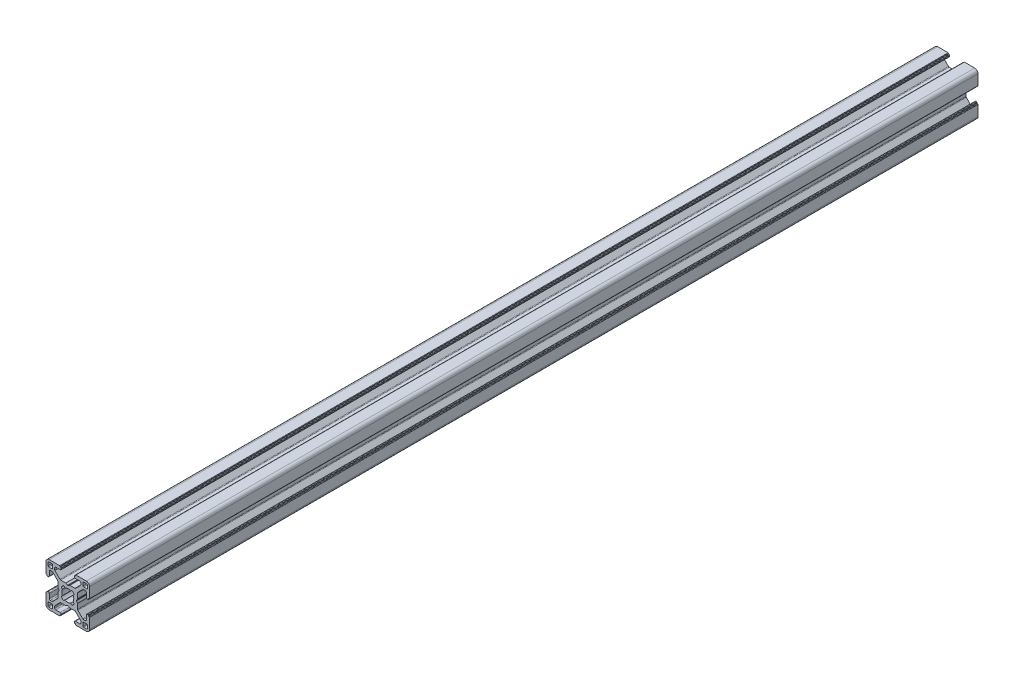
from build123d import *

# Parameters (mm, degrees)
ESTRUSIONE_ESTRUSIONE1_DEPTH = 408


with BuildPart() as part:
    # Schizzo1 → Estrusione-Estrusione1 (new body)
    with BuildSketch(Plane.XY.offset(100)):
        with BuildLine():
            Line((-9.299999732, 3), (-8.999999732, 3))
            ThreePointArc((-8.999999732, 3), (-8.646446341, 3.146446609), (-8.499999732, 3.5))
            Line((-8.499999732, 3.5), (-8.499999732, 5.499999605))
            ThreePointArc((-8.499999732, 5.499999605), (-8.353553123, 5.853552995), (-7.999999732, 5.999999605))
            Line((-7.999999732, 5.999999605), (-7.267766685, 5.999999605))
            ThreePointArc((-7.267766685, 5.999999605), (-7.076424969, 5.961939371), (-6.914213294, 5.853552995))
            Line((-6.914213294, 5.853552995), (-4.646446398, 3.585786099))
            ThreePointArc((-4.646446398, 3.585786099), (-4.538060023, 3.423574425), (-4.499999789, 3.232232708))
            Line((-4.499999789, 3.232232708), (-4.499999789, 0.953589302))
            ThreePointArc((-4.499999789, 0.953589302), (-4.493184953, 0.90182549), (-4.473204867, 0.853589297))
            Line((-4.473204867, 0.853589297), (-4.038119841, 0.099999969))
            ThreePointArc((-4.038119841, 0.099999969), (-4.011324929, 0), (-4.038119841, -0.099999969))
            Line((-4.038119841, -0.099999969), (-4.473204867, -0.853589297))
            ThreePointArc((-4.473204867, -0.853589297), (-4.493184953, -0.90182549), (-4.499999789, -0.953589302))
            Line((-4.499999789, -0.953589302), (-4.499999789, -3.232232708))
            ThreePointArc((-4.499999789, -3.232232708), (-4.538060023, -3.423574425), (-4.646446398, -3.585786099))
            Line((-4.646446398, -3.585786099), (-6.914213294, -5.853552995))
            ThreePointArc((-6.914213294, -5.853552995), (-7.076424969, -5.961939371), (-7.267766685, -5.999999605))
            Line((-7.267766685, -5.999999605), (-7.999999732, -5.999999605))
            ThreePointArc((-7.999999732, -5.999999605), (-8.353553123, -5.853552995), (-8.499999732, -5.499999605))
            Line((-8.499999732, -5.499999605), (-8.499999732, -3.5))
            ThreePointArc((-8.499999732, -3.5), (-8.646446341, -3.146446609), (-8.999999732, -3))
            Line((-8.999999732, -3), (-9.299999732, -3))
            ThreePointArc((-9.299999732, -3), (-9.441421088, -3.058578644), (-9.499999732, -3.2))
            Line((-9.499999732, -3.2), (-9.499999732, -3.349999605))
            ThreePointArc((-9.499999732, -3.349999605), (-9.558578376, -3.491420961), (-9.699999732, -3.549999605))
            Line((-9.699999732, -3.549999605), (-9.8, -3.549999605))
            ThreePointArc((-9.8, -3.549999605), (-9.941421356, -3.608578248), (-10, -3.749999605))
            Line((-10, -3.749999605), (-10, -8.5))
            ThreePointArc((-10, -8.5), (-9.560660172, -9.560660172), (-8.5, -10))
            Line((-8.5, -10), (-3.750000228, -10))
            ThreePointArc((-3.750000228, -10), (-3.608578871, -9.941421356), (-3.550000228, -9.8))
            Line((-3.550000228, -9.8), (-3.550000228, -9.7))
            ThreePointArc((-3.550000228, -9.7), (-3.491421584, -9.558578644), (-3.350000228, -9.5))
            Line((-3.350000228, -9.5), (-3.2, -9.5))
            ThreePointArc((-3.2, -9.5), (-3.058578644, -9.441421356), (-3, -9.3))
            Line((-3, -9.3), (-3, -8.999999673))
            ThreePointArc((-3, -8.999999673), (-3.146446609, -8.646446283), (-3.5, -8.499999673))
            Line((-3.5, -8.499999673), (-5.500000686, -8.499999673))
            ThreePointArc((-5.500000686, -8.499999673), (-5.853554077, -8.353553064), (-6.000000686, -7.999999673))
            Line((-6.000000686, -7.999999673), (-6.000000686, -7.267766626))
            ThreePointArc((-6.000000686, -7.267766626), (-5.961940448, -7.076424899), (-5.853554059, -6.914213219))
            Line((-5.853554059, -6.914213219), (-3.585787212, -4.646446592))
            ThreePointArc((-3.585787212, -4.646446592), (-3.423575544, -4.538060229), (-3.232233839, -4.5))
            Line((-3.232233839, -4.5), (-0.953590312, -4.5))
            ThreePointArc((-0.953590312, -4.5), (-0.901826505, -4.493185166), (-0.853590316, -4.473205083))
            Line((-0.853590316, -4.473205083), (-0.100000045, -4.038119562))
            ThreePointArc((-0.100000045, -4.038119562), (0, -4.011324632), (0.100000045, -4.038119562))
            Line((0.100000045, -4.038119562), (0.853590316, -4.473205083))
            ThreePointArc((0.853590316, -4.473205083), (0.901826505, -4.493185166), (0.953590312, -4.5))
            Line((0.953590312, -4.5), (3.23223292, -4.5))
            ThreePointArc((3.23223292, -4.5), (3.423574636, -4.538060234), (3.58578631, -4.646446609))
            Line((3.58578631, -4.646446609), (5.853554077, -6.914214376))
            ThreePointArc((5.853554077, -6.914214376), (5.961940452, -7.07642605), (6.000000686, -7.267767766))
            Line((6.000000686, -7.267767766), (6.000000686, -7.999999673))
            ThreePointArc((6.000000686, -7.999999673), (5.853554077, -8.353553064), (5.500000686, -8.499999673))
            Line((5.500000686, -8.499999673), (3.5, -8.499999673))
            ThreePointArc((3.5, -8.499999673), (3.146446609, -8.646446283), (3, -8.999999673))
            Line((3, -8.999999673), (3, -9.3))
            ThreePointArc((3, -9.3), (3.058578644, -9.441421356), (3.2, -9.5))
            Line((3.2, -9.5), (3.350000228, -9.5))
            ThreePointArc((3.350000228, -9.5), (3.491421584, -9.558578644), (3.550000228, -9.7))
            Line((3.550000228, -9.7), (3.550000228, -9.8))
            ThreePointArc((3.550000228, -9.8), (3.608578871, -9.941421356), (3.750000228, -10))
            Line((3.750000228, -10), (8.5, -10))
            ThreePointArc((8.5, -10), (9.560660172, -9.560660172), (10, -8.5))
            Line((10, -8.5), (10, -3.749999605))
            ThreePointArc((10, -3.749999605), (9.941421356, -3.608578248), (9.8, -3.549999605))
            Line((9.8, -3.549999605), (9.699999732, -3.549999605))
            ThreePointArc((9.699999732, -3.549999605), (9.558578376, -3.491420961), (9.499999732, -3.349999605))
            Line((9.499999732, -3.349999605), (9.499999732, -3.2))
            ThreePointArc((9.499999732, -3.2), (9.441421088, -3.058578644), (9.299999732, -3))
            Line((9.299999732, -3), (8.999999732, -3))
            ThreePointArc((8.999999732, -3), (8.646446341, -3.146446609), (8.499999732, -3.5))
            Line((8.499999732, -3.5), (8.499999732, -5.499999605))
            ThreePointArc((8.499999732, -5.499999605), (8.353553123, -5.853552995), (7.999999732, -5.999999605))
            Line((7.999999732, -5.999999605), (7.267766789, -5.999999605))
            ThreePointArc((7.267766789, -5.999999605), (7.076425084, -5.961939376), (6.914213416, -5.853553012))
            Line((6.914213416, -5.853553012), (4.646446415, -3.585786233))
            ThreePointArc((4.646446415, -3.585786233), (4.538060027, -3.423574553), (4.499999789, -3.232232825))
            Line((4.499999789, -3.232232825), (4.499999789, -0.953589302))
            ThreePointArc((4.499999789, -0.953589302), (4.493184953, -0.90182549), (4.473204867, -0.853589297))
            Line((4.473204867, -0.853589297), (4.038119841, -0.099999969))
            ThreePointArc((4.038119841, -0.099999969), (4.011324929, 0), (4.038119841, 0.099999969))
            Line((4.038119841, 0.099999969), (4.473204867, 0.853589297))
            ThreePointArc((4.473204867, 0.853589297), (4.493184953, 0.90182549), (4.499999789, 0.953589302))
            Line((4.499999789, 0.953589302), (4.499999789, 3.232232825))
            ThreePointArc((4.499999789, 3.232232825), (4.538060027, 3.423574553), (4.646446415, 3.585786233))
            Line((4.646446415, 3.585786233), (6.914213416, 5.853553012))
            ThreePointArc((6.914213416, 5.853553012), (7.076425084, 5.961939376), (7.267766789, 5.999999605))
            Line((7.267766789, 5.999999605), (7.999999732, 5.999999605))
            ThreePointArc((7.999999732, 5.999999605), (8.353553123, 5.853552995), (8.499999732, 5.499999605))
            Line((8.499999732, 5.499999605), (8.499999732, 3.5))
            ThreePointArc((8.499999732, 3.5), (8.646446341, 3.146446609), (8.999999732, 3))
            Line((8.999999732, 3), (9.299999732, 3))
            ThreePointArc((9.299999732, 3), (9.441421088, 3.058578644), (9.499999732, 3.2))
            Line((9.499999732, 3.2), (9.499999732, 3.349999605))
            ThreePointArc((9.499999732, 3.349999605), (9.558578376, 3.491420961), (9.699999732, 3.549999605))
            Line((9.699999732, 3.549999605), (9.8, 3.549999605))
            ThreePointArc((9.8, 3.549999605), (9.941421356, 3.608578248), (10, 3.749999605))
            Line((10, 3.749999605), (10, 8.5))
            ThreePointArc((10, 8.5), (9.560660172, 9.560660172), (8.5, 10))
            Line((8.5, 10), (3.750000228, 10))
            ThreePointArc((3.750000228, 10), (3.608578871, 9.941421356), (3.550000228, 9.8))
            Line((3.550000228, 9.8), (3.550000228, 9.7))
            ThreePointArc((3.550000228, 9.7), (3.491421584, 9.558578644), (3.350000228, 9.5))
            Line((3.350000228, 9.5), (3.2, 9.5))
            ThreePointArc((3.2, 9.5), (3.058578644, 9.441421356), (3, 9.3))
            Line((3, 9.3), (3, 8.999999673))
            ThreePointArc((3, 8.999999673), (3.146446609, 8.646446283), (3.5, 8.499999673))
            Line((3.5, 8.499999673), (5.500000686, 8.499999673))
            ThreePointArc((5.500000686, 8.499999673), (5.853554077, 8.353553064), (6.000000686, 7.999999673))
            Line((6.000000686, 7.999999673), (6.000000686, 7.267767766))
            ThreePointArc((6.000000686, 7.267767766), (5.961940452, 7.07642605), (5.853554077, 6.914214376))
            Line((5.853554077, 6.914214376), (3.58578631, 4.646446609))
            ThreePointArc((3.58578631, 4.646446609), (3.423574636, 4.538060234), (3.23223292, 4.5))
            Line((3.23223292, 4.5), (0.953590312, 4.5))
            ThreePointArc((0.953590312, 4.5), (0.901826505, 4.493185166), (0.853590316, 4.473205083))
            Line((0.853590316, 4.473205083), (0.100000045, 4.038119562))
            ThreePointArc((0.100000045, 4.038119562), (0, 4.011324632), (-0.100000045, 4.038119562))
            Line((-0.100000045, 4.038119562), (-0.853590316, 4.473205083))
            ThreePointArc((-0.853590316, 4.473205083), (-0.901826505, 4.493185166), (-0.953590312, 4.5))
            Line((-0.953590312, 4.5), (-3.232233839, 4.5))
            ThreePointArc((-3.232233839, 4.5), (-3.423575544, 4.538060229), (-3.585787212, 4.646446592))
            Line((-3.585787212, 4.646446592), (-5.853554059, 6.914213219))
            ThreePointArc((-5.853554059, 6.914213219), (-5.961940448, 7.076424899), (-6.000000686, 7.267766626))
            Line((-6.000000686, 7.267766626), (-6.000000686, 7.999999673))
            ThreePointArc((-6.000000686, 7.999999673), (-5.853554077, 8.353553064), (-5.500000686, 8.499999673))
            Line((-5.500000686, 8.499999673), (-3.5, 8.499999673))
            ThreePointArc((-3.5, 8.499999673), (-3.146446609, 8.646446283), (-3, 8.999999673))
            Line((-3, 8.999999673), (-3, 9.3))
            ThreePointArc((-3, 9.3), (-3.058578644, 9.441421356), (-3.2, 9.5))
            Line((-3.2, 9.5), (-3.350000228, 9.5))
            ThreePointArc((-3.350000228, 9.5), (-3.491421584, 9.558578644), (-3.550000228, 9.7))
            Line((-3.550000228, 9.7), (-3.550000228, 9.8))
            ThreePointArc((-3.550000228, 9.8), (-3.608578871, 9.941421356), (-3.750000228, 10))
            Line((-3.750000228, 10), (-8.5, 10))
            ThreePointArc((-8.5, 10), (-9.560660172, 9.560660172), (-10, 8.5))
            Line((-10, 8.5), (-10, 3.749999605))
            ThreePointArc((-10, 3.749999605), (-9.941421356, 3.608578248), (-9.8, 3.549999605))
            Line((-9.8, 3.549999605), (-9.699999732, 3.549999605))
            ThreePointArc((-9.699999732, 3.549999605), (-9.558578376, 3.491420961), (-9.499999732, 3.349999605))
            Line((-9.499999732, 3.349999605), (-9.499999732, 3.2))
            ThreePointArc((-9.499999732, 3.2), (-9.441421088, 3.058578644), (-9.299999732, 3))
        make_face()
        with BuildLine():
            Line((-1.91389502, 2.989640962), (-1.258185436, 2.445295362))
            ThreePointArc((-1.258185436, 2.445295362), (0, 2.75), (1.258185436, 2.445295362))
            Line((1.258185436, 2.445295362), (1.91389502, 2.989640962))
            ThreePointArc((1.91389502, 2.989640962), (2.511737261, 2.508410485), (2.992174953, 1.909930962))
            Line((2.992174953, 1.909930962), (2.445295423, 1.258185317))
            ThreePointArc((2.445295423, 1.258185317), (2.75, 0), (2.445295423, -1.258185317))
            Line((2.445295423, -1.258185317), (2.992174953, -1.909930962))
            ThreePointArc((2.992174953, -1.909930962), (2.511737261, -2.508410485), (1.91389502, -2.989640962))
            Line((1.91389502, -2.989640962), (1.258185436, -2.445295362))
            ThreePointArc((1.258185436, -2.445295362), (0, -2.75), (-1.258185436, -2.445295362))
            Line((-1.258185436, -2.445295362), (-1.91389502, -2.989640962))
            ThreePointArc((-1.91389502, -2.989640962), (-2.511737261, -2.508410485), (-2.992174953, -1.909930962))
            Line((-2.992174953, -1.909930962), (-2.445295423, -1.258185317))
            ThreePointArc((-2.445295423, -1.258185317), (-2.75, 0), (-2.445295423, 1.258185317))
            Line((-2.445295423, 1.258185317), (-2.992174953, 1.909930962))
            ThreePointArc((-2.992174953, 1.909930962), (-2.511737261, 2.508410485), (-1.91389502, 2.989640962))
        make_face(mode=Mode.SUBTRACT)
        with BuildLine():
            Line((8.699999314, 7.000000686), (7.3, 7.000000686))
            ThreePointArc((7.3, 7.000000686), (7.087867966, 7.087868652), (7, 7.300000686))
            Line((7, 7.300000686), (7, 8.7))
            ThreePointArc((7, 8.7), (7.087867966, 8.912132034), (7.3, 9))
            Line((7.3, 9), (8.699999314, 9))
            ThreePointArc((8.699999314, 9), (8.912131348, 8.912132034), (8.999999314, 8.7))
            Line((8.999999314, 8.7), (8.999999314, 7.300000686))
            ThreePointArc((8.999999314, 7.300000686), (8.912131348, 7.087868652), (8.699999314, 7.000000686))
        make_face(mode=Mode.SUBTRACT)
        with BuildLine():
            Line((-7.300000686, 7.000000686), (-8.7, 7.000000686))
            ThreePointArc((-8.7, 7.000000686), (-8.912132034, 7.087868652), (-9, 7.300000686))
            Line((-9, 7.300000686), (-9, 8.7))
            ThreePointArc((-9, 8.7), (-8.912132034, 8.912132034), (-8.7, 9))
            Line((-8.7, 9), (-7.300000686, 9))
            ThreePointArc((-7.300000686, 9), (-7.087868652, 8.912132034), (-7.000000686, 8.7))
            Line((-7.000000686, 8.7), (-7.000000686, 7.300000686))
            ThreePointArc((-7.000000686, 7.300000686), (-7.087868652, 7.087868652), (-7.300000686, 7.000000686))
        make_face(mode=Mode.SUBTRACT)
        with BuildLine():
            Line((8.699999314, -8.999999314), (7.3, -8.999999314))
            ThreePointArc((7.3, -8.999999314), (7.087867966, -8.912131348), (7, -8.699999314))
            Line((7, -8.699999314), (7, -7.3))
            ThreePointArc((7, -7.3), (7.087867966, -7.087867966), (7.3, -7))
            Line((7.3, -7), (8.699999314, -7))
            ThreePointArc((8.699999314, -7), (8.912131348, -7.087867966), (8.999999314, -7.3))
            Line((8.999999314, -7.3), (8.999999314, -8.699999314))
            ThreePointArc((8.999999314, -8.699999314), (8.912131348, -8.912131348), (8.699999314, -8.999999314))
        make_face(mode=Mode.SUBTRACT)
        with BuildLine():
            Line((-7.300000686, -8.999999314), (-8.7, -8.999999314))
            ThreePointArc((-8.7, -8.999999314), (-8.912132034, -8.912131348), (-9, -8.699999314))
            Line((-9, -8.699999314), (-9, -7.3))
            ThreePointArc((-9, -7.3), (-8.912132034, -7.087867966), (-8.7, -7))
            Line((-8.7, -7), (-7.300000686, -7))
            ThreePointArc((-7.300000686, -7), (-7.087868652, -7.087867966), (-7.000000686, -7.3))
            Line((-7.000000686, -7.3), (-7.000000686, -8.699999314))
            ThreePointArc((-7.000000686, -8.699999314), (-7.087868652, -8.912131348), (-7.300000686, -8.999999314))
        make_face(mode=Mode.SUBTRACT)
    extrude(amount=-ESTRUSIONE_ESTRUSIONE1_DEPTH)


solid = part.part
